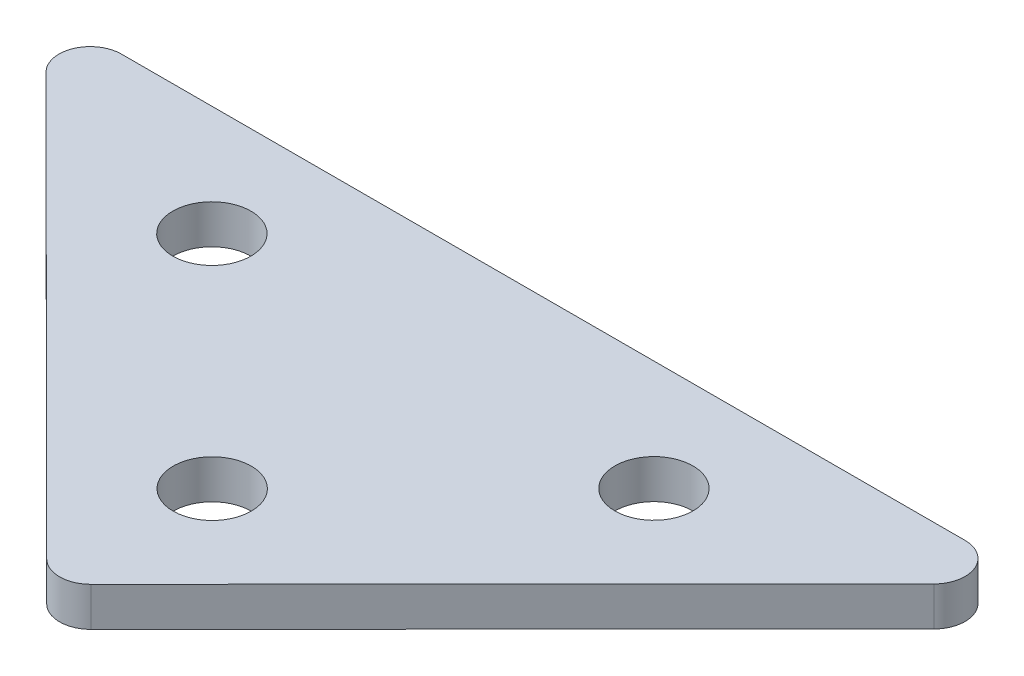
from build123d import *

# Parameters (mm, degrees)
BOSS_EXTRUDE1_DEPTH         = 3.175
F_1_4_0_25_DIAMETER_HOLE1_D = 6.35


with BuildPart() as part:
    # Outline → Boss-Extrude1 (new body)
    with BuildSketch(Plane(origin=(0, 94.633362877, 0), x_dir=(1, 0, 0), z_dir=(0, 1, 0))):
        with BuildLine():
            Line((177.759833239, -340.109313119), (212.01172464, -305.803125827))
            ThreePointArc((212.01172464, -305.803125827), (212.560135032, -303.034623493), (210.212239961, -301.46849838))
            Line((210.212239961, -301.46849838), (141.654161268, -301.522794271))
            ThreePointArc((141.654161268, -301.522794271), (139.308749787, -303.092636338), (139.861544626, -305.860266552))
            Line((139.861544626, -305.860266552), (174.167731917, -340.112157953))
            ThreePointArc((174.167731917, -340.112157953), (175.964371763, -340.854684078), (177.759833239, -340.109313119))
        make_face()
    extrude(amount=BOSS_EXTRUDE1_DEPTH)

    # 1/4 (0.25) Diameter Hole1 (through all)
    with Locations(Plane(origin=(0, 97.808362877, 0), x_dir=(1, 0, 0), z_dir=(0, 1, 0))):
        with Locations((157.97980609, -310.490123799), (175.954536868, -328.43640624), (193.900819309, -310.461675461)):
            Hole(F_1_4_0_25_DIAMETER_HOLE1_D / 2)


solid = part.part
